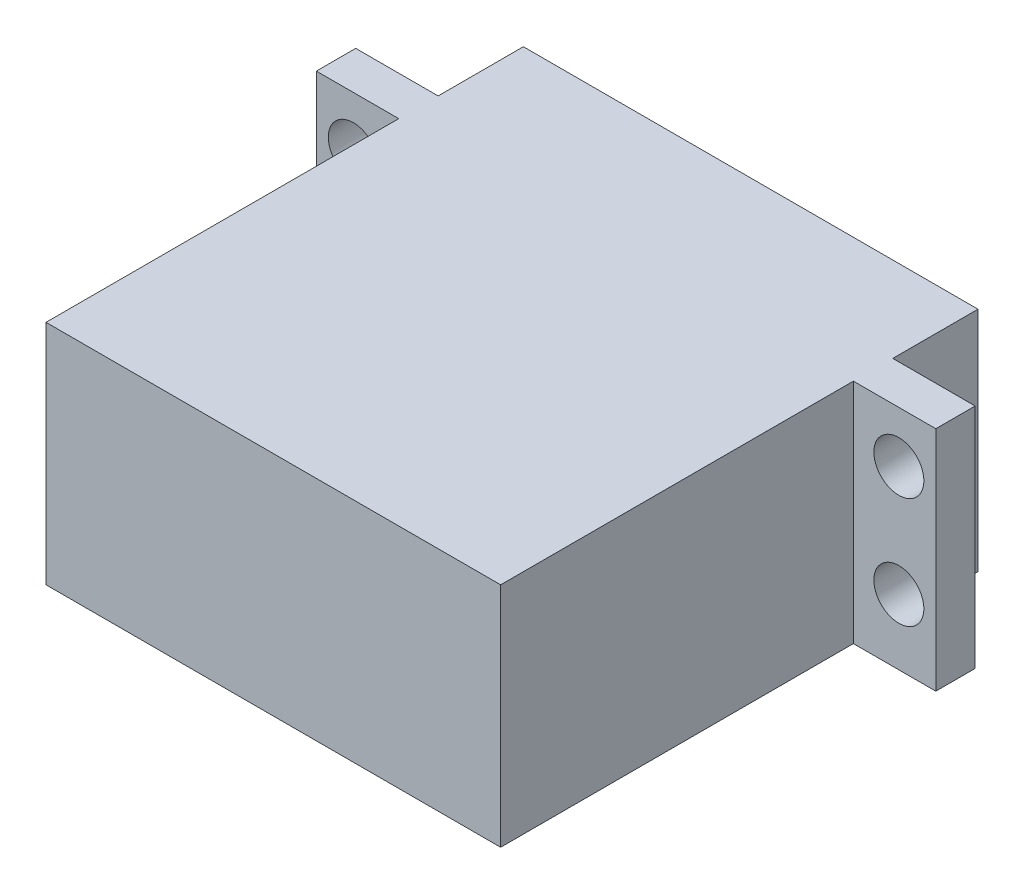
from build123d import *

# Parameters (mm, degrees)
SKETCH_1_W          = 40
SKETCH_1_H          = 42
EXTRUDE_1_DEPTH     = 20
SKETCH_2_W          = 3.463290034
SKETCH_2_H          = 20
EXTRUDE_2_DEPTH     = 7.25
SKETCH_3_R          = 2.2
CUT_EXTRUDE_1_DEPTH = 7.25
SKETCH_4_R          = 3
EXTRUDE_3_DEPTH     = 5
SKETCH_5_R          = 1.5
CUT_EXTRUDE_2_DEPTH = 5


with BuildPart() as part:
    # Эскиз1 → Бобышка-Вытянуть1 (new body)
    with BuildSketch(Plane(origin=(0, 0, 0), x_dir=(1, 0, 0), z_dir=(0, 1, 0))):
        Rectangle(SKETCH_1_W, SKETCH_1_H)
    extrude(amount=EXTRUDE_1_DEPTH)

    # Эскиз2 → Бобышка-Вытянуть2 (add)
    with BuildSketch(Plane(origin=(20, 0, 0), x_dir=(0, 0, -1), z_dir=(1, 0, 0))):
        with Locations((11.768354983, 10)):
            Rectangle(SKETCH_2_W, SKETCH_2_H)
    extrude_2 = extrude(amount=EXTRUDE_2_DEPTH)

    # Эскиз3 → Вырез-Вытянуть1 (cut)
    with BuildSketch(Plane(origin=(0, 0, -13.5), x_dir=(-1, 0, 0), z_dir=(0, 0, -1))):
        with Locations((-24, 15.5)):
            Circle(SKETCH_3_R)
        with Locations((-24, 5.75)):
            Circle(SKETCH_3_R)
    cut_extrude_1 = extrude(amount=-CUT_EXTRUDE_1_DEPTH, mode=Mode.SUBTRACT)

    # Зеркальное отражение2: Бобышка-Вытянуть2, Вырез-Вытянуть1 across plane
    add(extrude_2.mirror(Plane.ZY))
    add(cut_extrude_1.mirror(Plane.ZY), mode=Mode.SUBTRACT)

    # Эскиз4 → Бобышка-Вытянуть3 (add)
    with BuildSketch(Plane(origin=(0, 0, -21), x_dir=(-1, 0, 0), z_dir=(0, 0, -1))):
        with Locations(Location((10, 10, 0), (0, 0, 180))):
            Circle(SKETCH_4_R)
    extrude(amount=EXTRUDE_3_DEPTH)

    # Эскиз5 → Вырез-Вытянуть2 (cut)
    with BuildSketch(Plane(origin=(0, 0, -26), x_dir=(-1, 0, 0), z_dir=(0, 0, -1))):
        with Locations((10, 10)):
            Circle(SKETCH_5_R)
    extrude(amount=-CUT_EXTRUDE_2_DEPTH, mode=Mode.SUBTRACT)


solid = part.part
